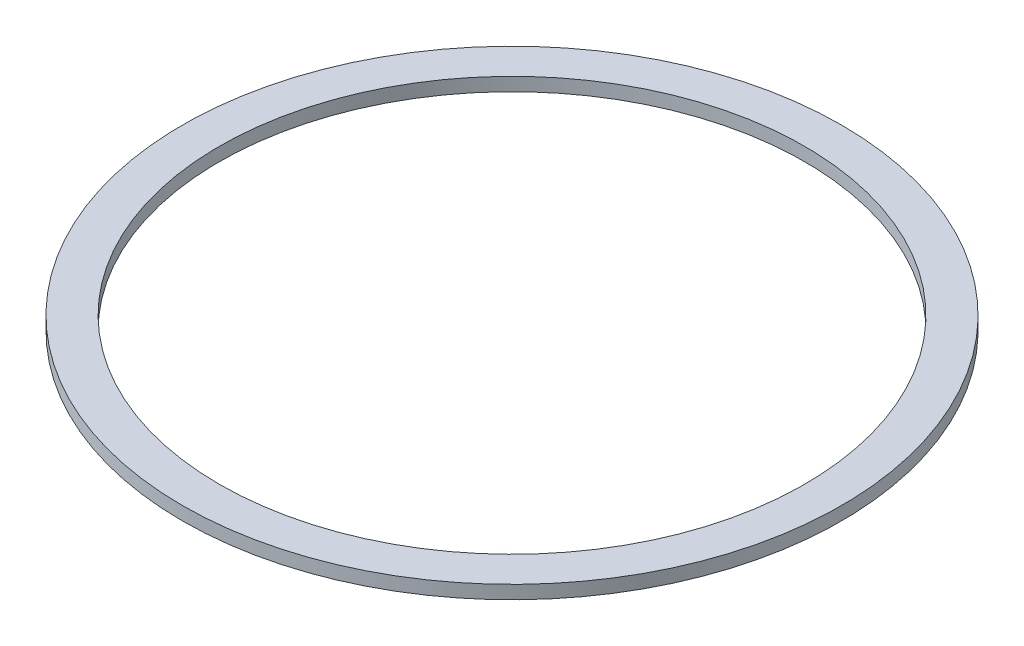
from build123d import *

# Parameters (mm, degrees)
SKETCH1_R           = 78.359
SKETCH1_R_2         = 69.596
BOSS_EXTRUDE1_DEPTH = 3.175


with BuildPart() as part:
    # Sketch1 → Boss-Extrude1 (new body)
    with BuildSketch(Plane(origin=(0, 0, 0), x_dir=(1, 0, 0), z_dir=(0, 1, 0))):
        with Locations(Location((0, 0, 0), (0, 0, 270))):
            Circle(SKETCH1_R)
        with Locations(Location((0, 0, 0), (0, 0, 270))):
            Circle(SKETCH1_R_2, mode=Mode.SUBTRACT)
    extrude(amount=BOSS_EXTRUDE1_DEPTH)


solid = part.part
